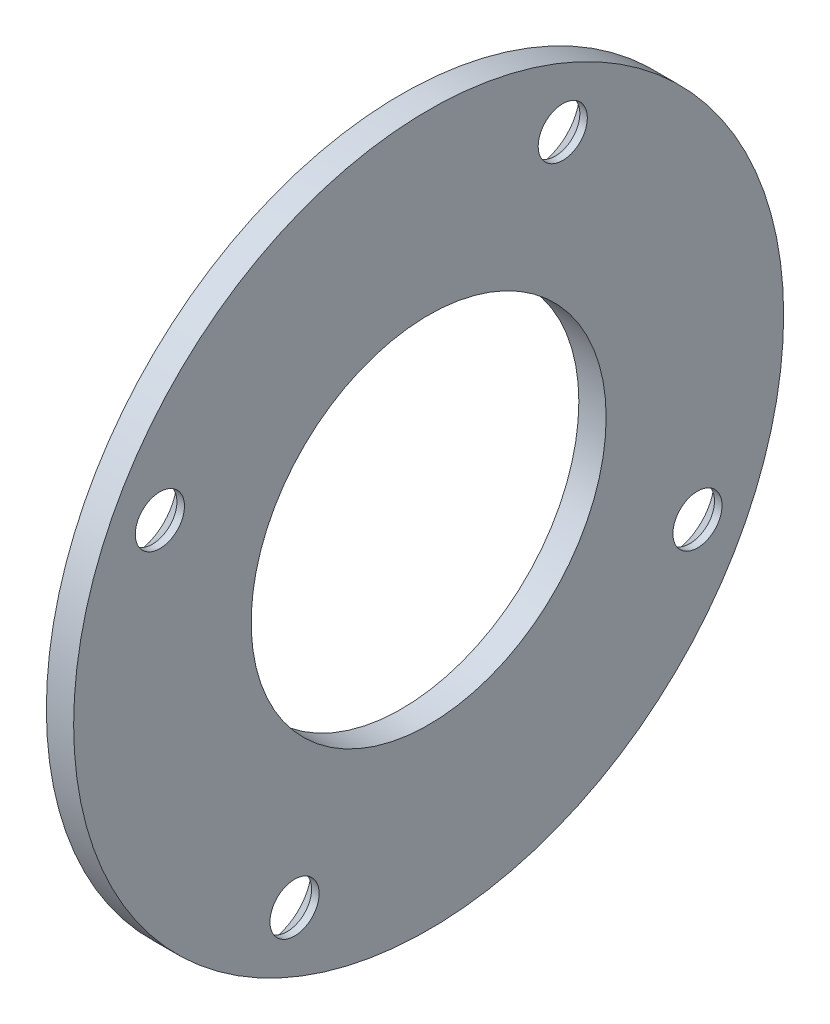
from build123d import *

# Parameters (mm, degrees)
SKETCH_1_R               = 26
SKETCH_1_R_2             = 13
EXTRUDE_1_DEPTH          = 2
PATTERN_CIRCULAR_1_COUNT = 4


with BuildPart() as part:
    # Эскиз1 → Бобышка-Вытянуть1 (new body)
    with BuildSketch(Plane(origin=(0, 0, 0), x_dir=(0, 0, -1), z_dir=(1, 0, 0))):
        Circle(SKETCH_1_R)
        Circle(SKETCH_1_R_2, mode=Mode.SUBTRACT)
    extrude(amount=EXTRUDE_1_DEPTH)

    # Эскиз7 → Зенковка для винта с полупотайной головкой M32 (revolve, cut)
    with BuildSketch(Plane(origin=(0, 9.821468084, 19.686004284), x_dir=(0, 0, 1), z_dir=(0, 1, 0))):
        Polygon((0, 0), (0, 2), (1.8, 2), (1.8, 1.45), (3.25, 0), align=None)
    hole_wizard_m32 = revolve(axis=Axis((-6.35, 9.821468084, 19.686004284), (1, 0, 0)), mode=Mode.SUBTRACT)

    # Круговой массив1: Зенковка для винта с полупотайной головкой M32 ×4 about axis
    pattern_circular_1_axis = Axis((0, 0, 0), (1, 0, 0))
    for i in range(1, PATTERN_CIRCULAR_1_COUNT):
        add(hole_wizard_m32.rotate(pattern_circular_1_axis, i * 360 / PATTERN_CIRCULAR_1_COUNT), mode=Mode.SUBTRACT)


solid = part.part
